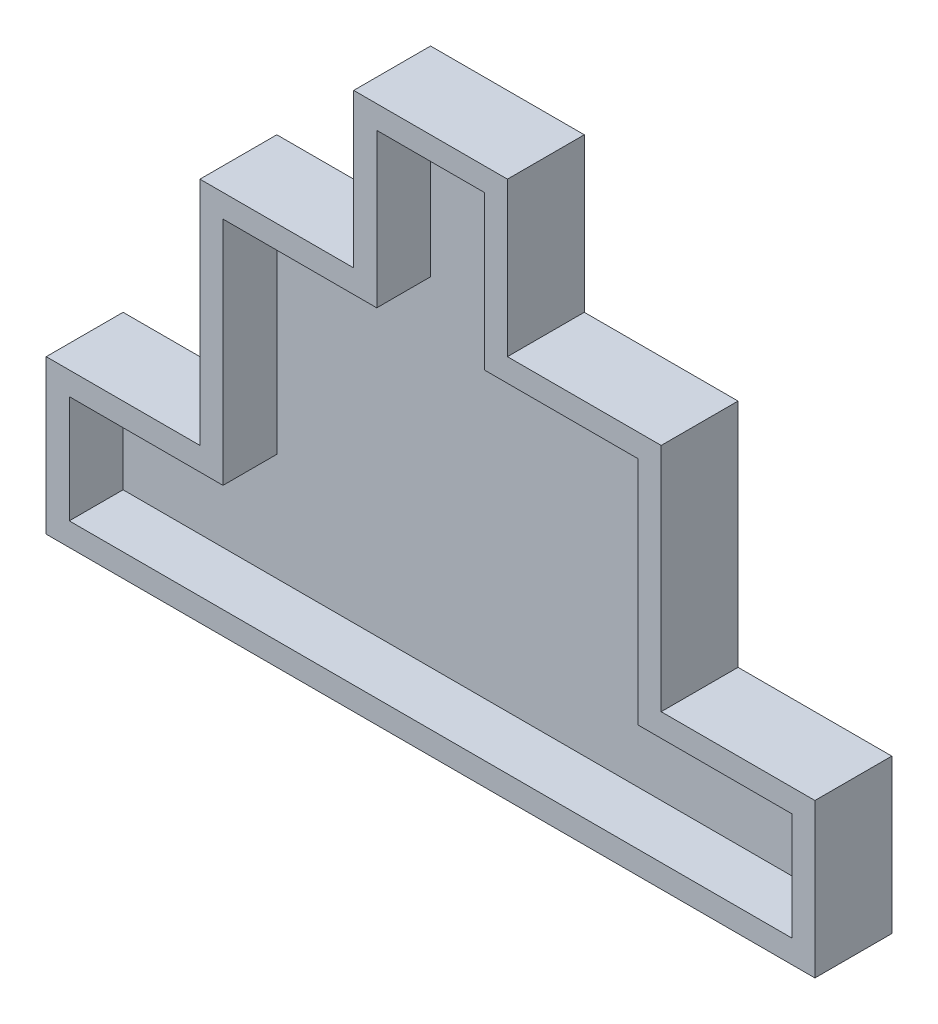
from build123d import *

# Parameters (mm, degrees)
Y_KSEKLIK_EKSTR_ZYON3_DEPTH = 4.5
Y_KSEKLIK_EKSTR_ZYON4_DEPTH = 10.5


with BuildPart() as part:
    # Çizim2 → Yükseklik-Ekstrüzyon3 (new body)
    with BuildSketch(Plane.XY):
        Polygon((-75, -52.5), (-75, -22.5), (-45, -22.5), (-45, 22.5), (-15, 22.5), (-15, 52.5), (15, 52.5), (15, 22.5), (45, 22.5), (45, -22.5), (75, -22.5), (75, -52.5), align=None)
    extrude(amount=Y_KSEKLIK_EKSTR_ZYON3_DEPTH)

    # Çizim4 → Yükseklik-Ekstrüzyon4 (add)
    with BuildSketch(Plane.XY.offset(4.5)):
        Polygon((-15, 22.5), (-45, 22.5), (-45, -22.5), (-75, -22.5), (-75, -52.5), (75, -52.5), (75, -22.5), (45, -22.5), (45, 22.5), (15, 22.5), (15, 52.5), (-15, 52.5), align=None)
        Polygon((-10.5, 18), (-40.5, 18), (-40.5, -27), (-70.5, -27), (-70.5, -48), (70.5, -48), (70.5, -27), (40.5, -27), (40.5, 18), (10.5, 18), (10.5, 48), (-10.5, 48), align=None, mode=Mode.SUBTRACT)
    extrude(amount=Y_KSEKLIK_EKSTR_ZYON4_DEPTH)


solid = part.part
